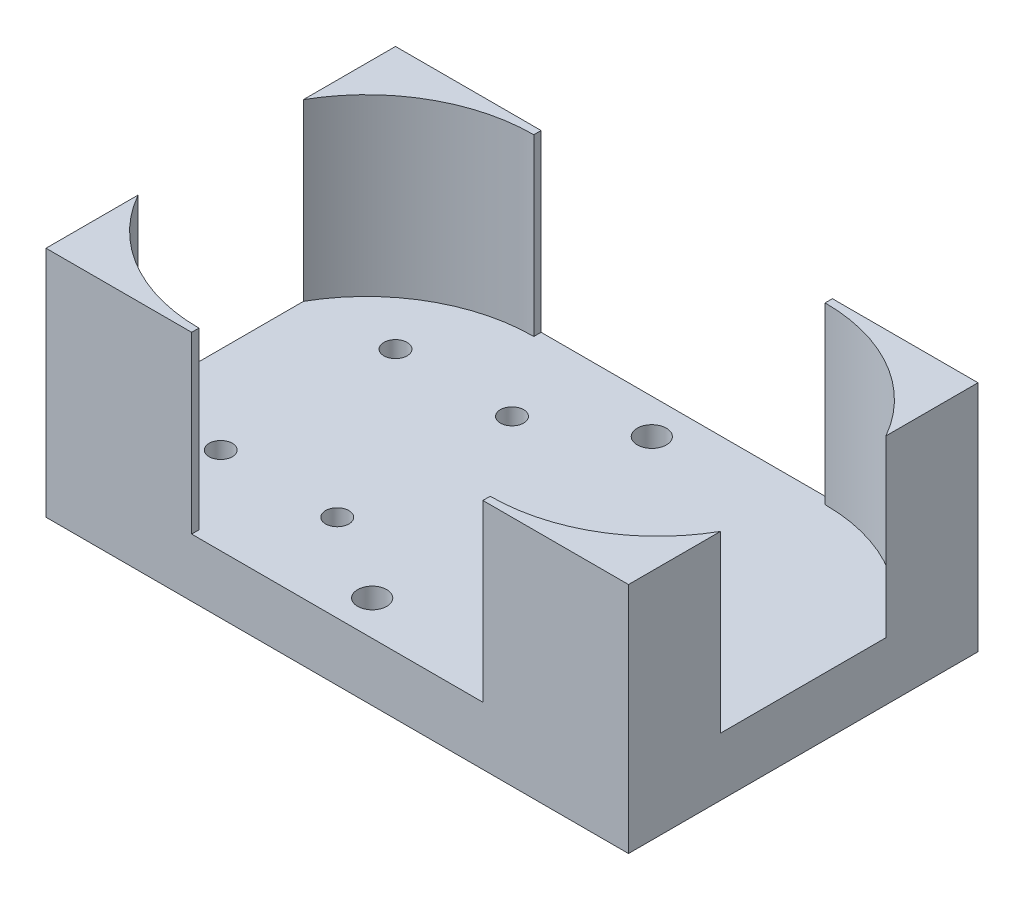
from build123d import *

# Parameters (mm, degrees)
SKETCH_1_W          = 20
SKETCH_1_H          = 12
EXTRUDE_1_DEPTH     = 2
EXTRUDE_2_DEPTH     = 6
SKETCH_5_R          = 0.5
CUT_EXTRUDE_1_DEPTH = 25.657656012
SKETCH_5_3_R        = 1
CUT_EXTRUDE_2_DEPTH = 1
SKETCH_6_R          = 0.4
CUT_EXTRUDE_3_DEPTH = 25.657656012


with BuildPart() as part:
    # 草图1 → 凸台-拉伸1 (new body)
    with BuildSketch(Plane(origin=(0, 0, 0), x_dir=(1, 0, 0), z_dir=(0, 1, 0))):
        with Locations((10, 6)):
            Rectangle(SKETCH_1_W, SKETCH_1_H)
    extrude(amount=EXTRUDE_1_DEPTH)

    # 草图4 → 凸台-拉伸2 (add)
    with BuildSketch(Plane(origin=(0, 2, 0), x_dir=(1, 0, 0), z_dir=(0, 1, 0))):
        with BuildLine():
            Line((5, 11.75), (5, 12))
            Line((5, 12), (0, 12))
            Line((0, 12), (0, 8.839454173))
            ThreePointArc((0, 8.839454173), (2.107281684, 10.969374281), (5, 11.75))
        make_face()
        with BuildLine():
            Line((5, 0), (5, 0.25))
            ThreePointArc((5, 0.25), (2.107281684, 1.030625719), (0, 3.160545827))
            Line((0, 3.160545827), (0, 0))
            Line((0, 0), (5, 0))
        make_face()
        with BuildLine():
            Line((20, 12), (15, 12))
            Line((15, 12), (15, 11.75))
            ThreePointArc((15, 11.75), (17.892718316, 10.969374281), (20, 8.839454173))
            Line((20, 8.839454173), (20, 12))
        make_face()
        with BuildLine():
            ThreePointArc((20, 3.160545827), (17.892718316, 1.030625719), (15, 0.25))
            Line((15, 0.25), (15, 0))
            Line((15, 0), (20, 0))
            Line((20, 0), (20, 3.160545827))
        make_face()
    extrude(amount=EXTRUDE_2_DEPTH)

    # 草图5 → 切除-拉伸1 (cut, through all)
    with BuildSketch(Plane.XZ):
        with Locations(Location((10, -1.2, 0), (0, 0, 270))):
            Circle(SKETCH_5_R)
        with Locations(Location((10, -10.8, 0), (0, 0, 270))):
            Circle(SKETCH_5_R)
    extrude(amount=-CUT_EXTRUDE_1_DEPTH, mode=Mode.SUBTRACT)

    # 草图5<3> → 切除-拉伸2 (cut)
    with BuildSketch(Plane.XZ):
        with Locations(Location((10, -1.2, 0), (0, 0, 270))):
            Circle(SKETCH_5_3_R)
        with Locations(Location((10, -10.8, 0), (0, 0, 270))):
            Circle(SKETCH_5_3_R)
    extrude(amount=-CUT_EXTRUDE_2_DEPTH, mode=Mode.SUBTRACT)

    # 草图6 → 切除-拉伸3 (cut, through all)
    with BuildSketch(Plane.XZ):
        with Locations(Location((3, -3, 0), (0, 0, 270))):
            Circle(SKETCH_6_R)
        with Locations(Location((3, -9, 0), (0, 0, 270))):
            Circle(SKETCH_6_R)
        with Locations(Location((7, -9, 0), (0, 0, 270))):
            Circle(SKETCH_6_R)
        with Locations(Location((7, -3, 0), (0, 0, 270))):
            Circle(SKETCH_6_R)
    extrude(amount=-CUT_EXTRUDE_3_DEPTH, mode=Mode.SUBTRACT)


solid = part.part
